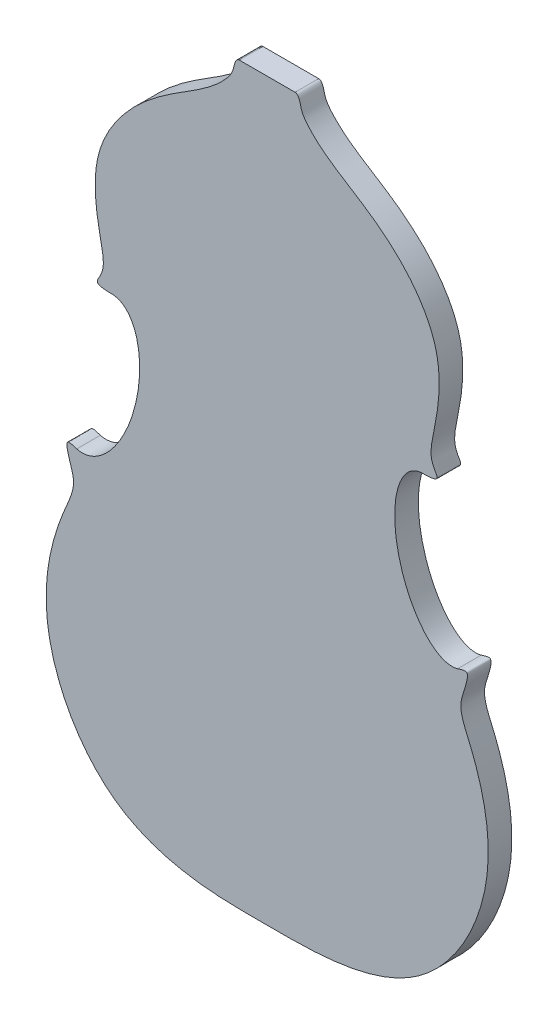
from build123d import *

# Parameters (mm, degrees)
BOSS_EXTRUDE1_DEPTH = 33.528


with BuildPart() as part:
    # Sketch5 → Boss-Extrude1 (new body)
    with BuildSketch(Plane.XY):
        with BuildLine():
            Line((0, -554.967468443), (0, 489.229569363))
            Line((0, 489.229569363), (39.526005164, 489.229569363))
            add(Edge.make_bspline(
                [(39.526005164, 489.229569363), (41.994165882, 489.229569363), (46.580457916, 483.708971039), (47.762318429, 469.539805459), (74.770347257, 435.758695832), (127.346779033, 407.12922115), (196.147624771, 356.264111054), (250.121842796, 278.719817652), (243.79696391, 200.259757547), (231.400647678, 148.667774361), (233.206586123, 129.473919565), (246.106067893, 111.456905789), (223.550549609, 111.013477767), (219.991214235, 111.047612516)],
                knots=[0, 0, 0, 0, 0.004292658, 0.013712553, 0.029409302, 0.091800128, 0.139494611, 0.210642635, 0.278267171, 0.300684525, 0.318441442, 0.325161593, 0.331714411, 0.331714411, 0.331714411, 0.331714411], degree=3))
            add(Edge.make_bspline(
                [(219.991214235, 111.047612516), (159.68013229, 108.939830382), (186.55046225, -5.929613161), (213.42079221, -120.799056703), (270.371015496, -104.32375602)],
                knots=[3.030119447, 3.030119447, 3.030119447, 4.663495081, 4.663495081, 6.296870715, 6.296870715, 6.296870715], degree=2, weights=[1, 0.684639149, 1, 0.684639149, 1]))
            add(Edge.make_bspline(
                [(270.371015496, -104.32375602), (281.787258307, -100.433002015), (286.665344414, -102.974391332), (280.053446734, -125.948208538), (270.840593782, -151.662507255), (307.762242936, -226.693334601), (330.768683107, -359.325942549), (234.516639483, -526.575397488), (103.980282593, -554.029663017), (29.314144201, -555.029340186), (6.953884561, -554.967468443), (0, -554.967468443)],
                knots=[0.531515794, 0.531515794, 0.531515794, 0.531515794, 0.541192242, 0.555870224, 0.570209623, 0.600541868, 0.716993045, 0.84910038, 0.951451168, 0.984334692, 1, 1, 1, 1], degree=3))
        make_face()
    extrude(amount=-BOSS_EXTRUDE1_DEPTH)

    # Mirror1: part across plane


with BuildPart() as part_1:
    add(part.part)
    add(part.part.mirror(Plane(origin=(0, -554.967468443, -33.528), x_dir=(0, 0, 1), z_dir=(1, 0, 0))))


solid = part_1.part
